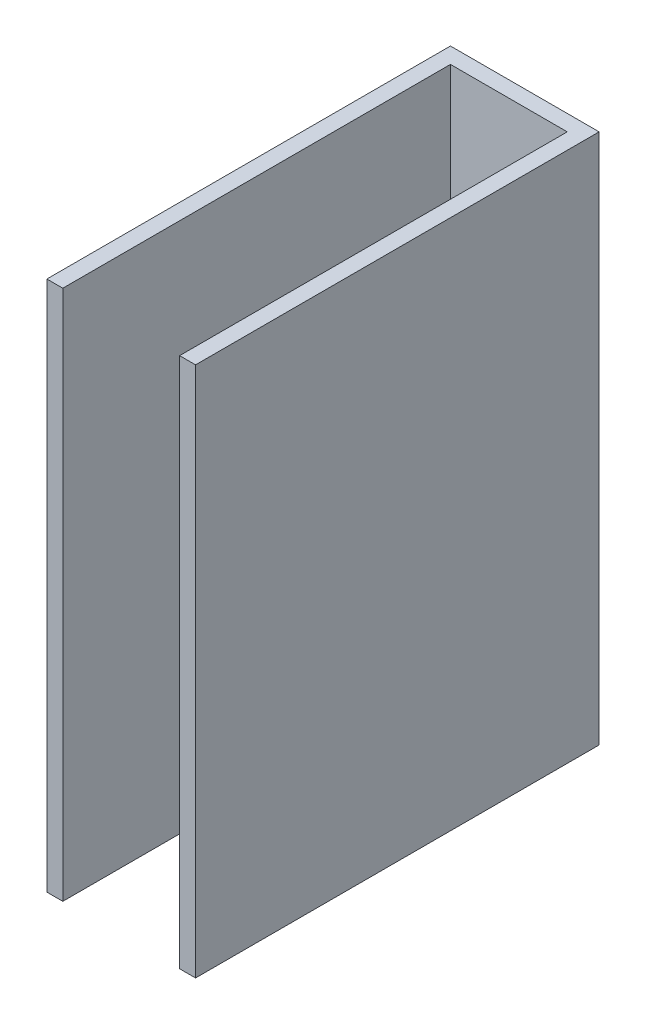
from build123d import *

# Parameters (mm, degrees)
BOSS_EXTRUDE1_DEPTH = 100


with BuildPart() as part:
    # Sketch1 → Boss-Extrude1 (new body)
    with BuildSketch(Plane(origin=(0, 0, 0), x_dir=(1, 0, 0), z_dir=(0, 1, 0))):
        Polygon((0, 0), (0, -73), (-3, -73), (-3, 3), (25, 3), (25, -73), (22, -73), (22, 0), align=None)
    extrude(amount=BOSS_EXTRUDE1_DEPTH)


solid = part.part
